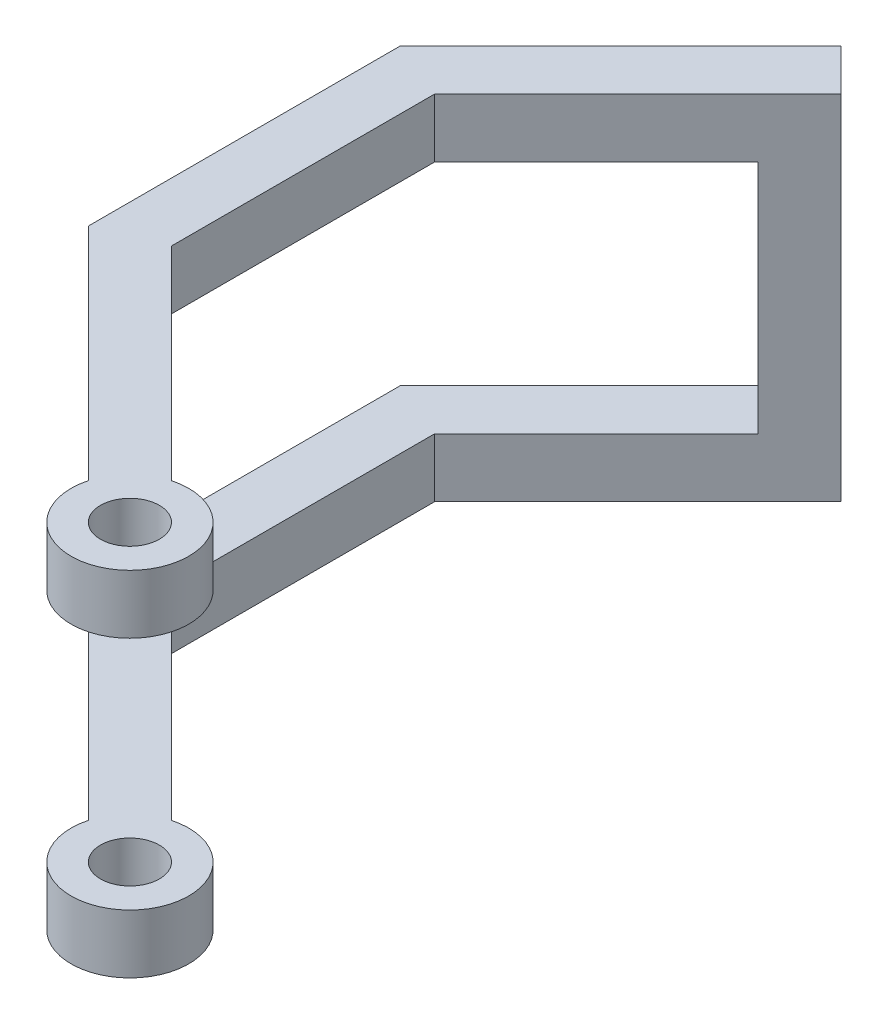
from build123d import *

# Parameters (mm, degrees)
SKETCH_1_R          = 5
EXTRUDE_1_DEPTH     = 60
SKETCH_3_W          = 37.476659403
SKETCH_3_H          = 40
SKETCH_3_W_2        = 53
SKETCH_3_W_3        = 50.064849854
CUT_EXTRUDE_1_DEPTH = 58
EXTRUDE_2_DEPTH     = 40


with BuildPart() as part:
    # 草图1 → 凸台-拉伸1 (new body)
    with BuildSketch(Plane(origin=(0, 0, 0), x_dir=(1, 0, 0), z_dir=(0, 1, 0))):
        with BuildLine():
            Line((0, 0), (-37.476659403, 37.476659403))
            Line((-37.476659403, 37.476659403), (-37.476659403, 90.476659403))
            Line((-37.476659403, 90.476659403), (0, 127.953318806))
            Line((0, 127.953318806), (7.071067812, 120.882250994))
            Line((7.071067812, 120.882250994), (-27.476659403, 86.334523779))
            Line((-27.476659403, 86.334523779), (-27.476659403, 41.618795027))
            Line((-27.476659403, 41.618795027), (7.071067812, 7.071067812))
            ThreePointArc((7.071067812, 7.071067812), (16.730326075, -9.659258263), (0, 0))
        make_face()
        with Locations(Location((9.659258263, -2.588190451, 0), (0, 0, 270))):
            Circle(SKETCH_1_R, mode=Mode.SUBTRACT)
    extrude(amount=EXTRUDE_1_DEPTH)

    # 草图3 → 切除-拉伸1 (cut)
    with BuildSketch(Plane.ZY.offset(37.476659403)):
        with Locations((-109.214989105, 30)):
            Rectangle(SKETCH_3_W, SKETCH_3_H)
        with Locations((-63.976659403, 30)):
            Rectangle(SKETCH_3_W_2, SKETCH_3_H)
        with Locations((-12.444234476, 30)):
            Rectangle(SKETCH_3_W_3, SKETCH_3_H)
    extrude(amount=-CUT_EXTRUDE_1_DEPTH, mode=Mode.SUBTRACT)


with BuildPart() as cut_extrude_1_piece_1:
    # of the separate pieces the step leaves, piece 1, a body of its own (cut_extrude_1_pieces)
    add(part.part.solids().sort_by_distance((7.071067812, 0, -7.071067812))[0])



with BuildPart() as cut_extrude_1_piece_2:
    # of the separate pieces the step leaves, piece 2, a body of its own (cut_extrude_1_pieces)
    add(part.part.solids().sort_by_distance((0, 50, 0))[0])


with BuildPart() as cut_extrude_1_piece_1_1:
    add(cut_extrude_1_piece_1.part)

    add(cut_extrude_1_piece_2.part)  # 凸台-拉伸2 merges 切除-拉伸1 piece 2
    # 草图4 → 凸台-拉伸2 (add)
    with BuildSketch(Plane(origin=(0, 10, 0), x_dir=(1, 0, 0), z_dir=(0, 1, 0))):
        Polygon((0, 127.953318806), (7.071067812, 120.882250994), (0, 113.811183182), (-7.071067812, 120.882250994), align=None)
    extrude(amount=EXTRUDE_2_DEPTH)


solid = cut_extrude_1_piece_1_1.part
